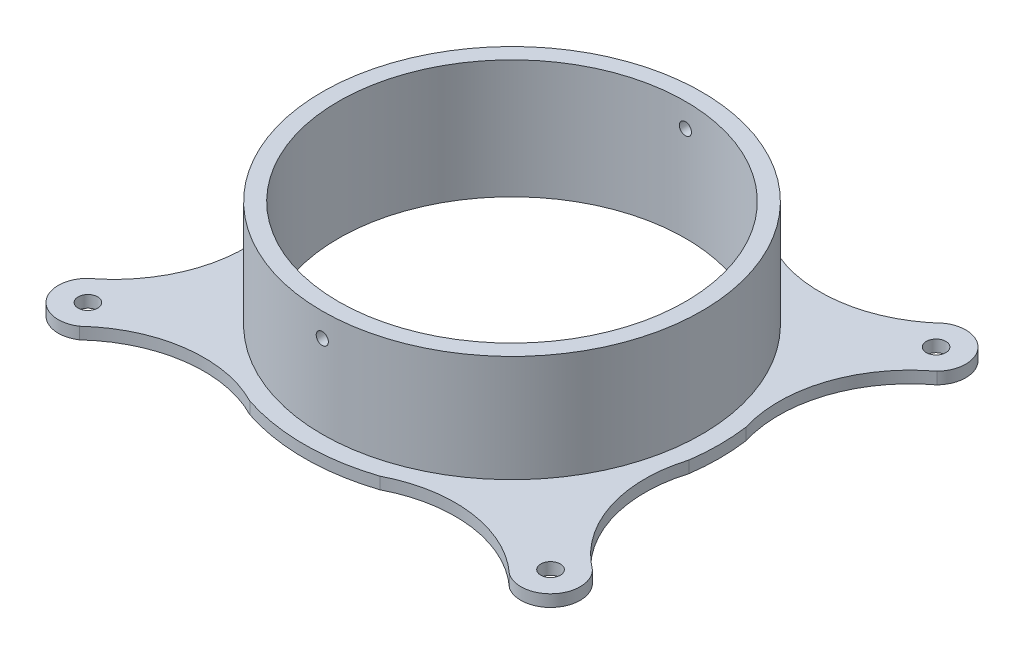
from build123d import *

# Parameters (mm, degrees)
EXTRUDE_2_DEPTH     = 2
SKETCH_2_R          = 32
EXTRUDE_3_DEPTH     = 18
SKETCH_10_W         = 1.025
SKETCH_10_H         = 37.5
HOLE_WIZARD_M4_2_D  = 3.3
HOLE_WIZARD_M60_2_D = 58.5


with BuildPart() as part:
    # 草图1 → 凸台-拉伸2 (new body)
    with BuildSketch(Plane(origin=(0, 0, 0), x_dir=(1, 0, 0), z_dir=(0, 1, 0))):
        with BuildLine():
            ThreePointArc((36.247895087, 36.674436315), (42.841106398, 35.700921998), (42.609721719, 29.040244357))
            ThreePointArc((42.609721719, 29.040244357), (34.804095286, 18.178082868), (34.668896044, 4.802879043))
            ThreePointArc((34.668896044, 4.802879043), (35, 0), (34.668896044, -4.802879043))
            ThreePointArc((34.668896044, -4.802879043), (34.804095286, -18.178082868), (42.609721719, -29.040244357))
            ThreePointArc((42.609721719, -29.040244357), (42.841106398, -35.700921998), (36.247895087, -36.674436315))
            ThreePointArc((36.247895087, -36.674436315), (24.15622984, -30.955521404), (10.97591146, -33.234460544))
            ThreePointArc((10.97591146, -33.234460544), (0, -35), (-10.97591146, -33.234460544))
            ThreePointArc((-10.97591146, -33.234460544), (-24.15622984, -30.955521404), (-36.247895087, -36.674436315))
            ThreePointArc((-36.247895087, -36.674436315), (-42.841106398, -35.700921998), (-42.609721719, -29.040244357))
            ThreePointArc((-42.609721719, -29.040244357), (-34.804095286, -18.178082868), (-34.668896044, -4.802879043))
            ThreePointArc((-34.668896044, -4.802879043), (-35, 0), (-34.668896044, 4.802879043))
            ThreePointArc((-34.668896044, 4.802879043), (-34.804095286, 18.178082868), (-42.609721719, 29.040244357))
            ThreePointArc((-42.609721719, 29.040244357), (-42.841106398, 35.700921998), (-36.247895087, 36.674436315))
            ThreePointArc((-36.247895087, 36.674436315), (-24.15622984, 30.955521404), (-10.97591146, 33.234460544))
            ThreePointArc((-10.97591146, 33.234460544), (0, 35), (10.97591146, 33.234460544))
            ThreePointArc((10.97591146, 33.234460544), (24.15622984, 30.955521404), (36.247895087, 36.674436315))
        make_face()
    extrude(amount=EXTRUDE_2_DEPTH)

    # 草图2 → 凸台-拉伸3 (add)
    with BuildSketch(Plane(origin=(0, 2, 0), x_dir=(1, 0, 0), z_dir=(0, 1, 0))):
        with Locations(Location((0, 0, 0), (0, 0, 270))):
            Circle(SKETCH_2_R)
    extrude(amount=EXTRUDE_3_DEPTH)

    # 草图10 → M2.5 螺纹孔1 (revolve, cut)
    with BuildSketch(Plane(origin=(0, 16, 0), x_dir=(0, 1, 0), z_dir=(1, 0, 0))):
        with Locations((0.5125, 18.75)):
            Rectangle(SKETCH_10_W, SKETCH_10_H)
    hole_wizard_m2_5_1 = revolve(axis=Axis((0, 16, -6.35), (0, 0, 1)), mode=Mode.SUBTRACT)

    # 镜向3: M2.5 螺纹孔1 across plane
    add(hole_wizard_m2_5_1.mirror(Plane.XY), mode=Mode.SUBTRACT)

    # M4 螺纹孔2 (through all)
    with Locations(Plane(origin=(0, 20, 0), x_dir=(1, 0, 0), z_dir=(0, 1, 0))):
        with Locations((-39, 32.5), (-39, -32.5), (39, -32.5), (39, 32.5)):
            Hole(HOLE_WIZARD_M4_2_D / 2)

    # M60 螺纹孔2 (through all)
    with Locations(Plane(origin=(0, 20, 0), x_dir=(1, 0, 0), z_dir=(0, 1, 0))):
        with Locations((0, 0)):
            Hole(HOLE_WIZARD_M60_2_D / 2)


solid = part.part
